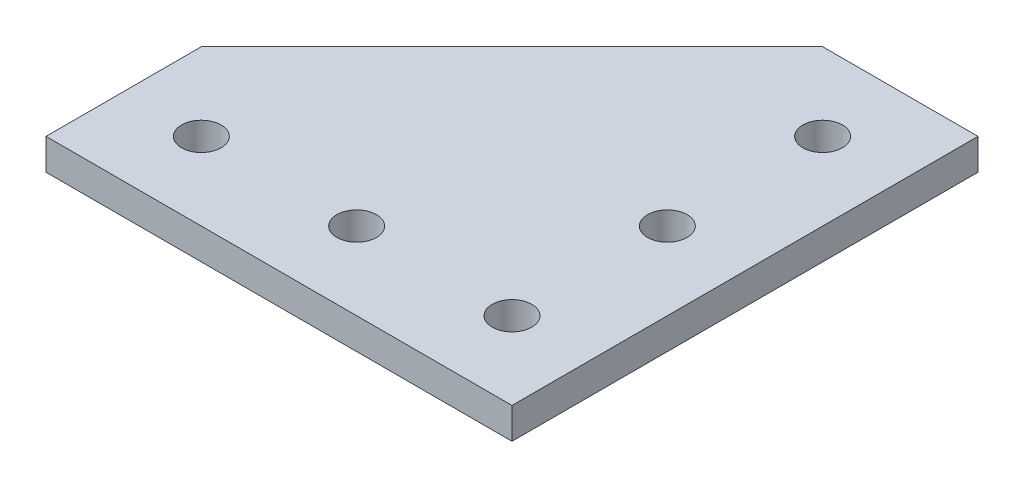
from build123d import *

# Parameters (mm, degrees)
SKETCH1_R           = 2.55
BOSS_EXTRUDE1_DEPTH = 4


with BuildPart() as part:
    # Sketch1 → Boss-Extrude1 (new body)
    with BuildSketch(Plane(origin=(0, 0, 0), x_dir=(1, 0, 0), z_dir=(0, 1, 0))):
        Polygon((10, -10), (-50, -10), (-50, 10), (-10, 50), (10, 50), align=None)
        with Locations(Location((-20, 0, 0), (0, 0, 270))):
            Circle(SKETCH1_R, mode=Mode.SUBTRACT)
        with Locations(Location((-40, 0, 0), (0, 0, 270))):
            Circle(SKETCH1_R, mode=Mode.SUBTRACT)
        with Locations(Location((0, 0, 0), (0, 0, 270))):
            Circle(SKETCH1_R, mode=Mode.SUBTRACT)
        with Locations(Location((0, 20, 0), (0, 0, 270))):
            Circle(SKETCH1_R, mode=Mode.SUBTRACT)
        with Locations(Location((0, 40, 0), (0, 0, 270))):
            Circle(SKETCH1_R, mode=Mode.SUBTRACT)
    extrude(amount=BOSS_EXTRUDE1_DEPTH)


solid = part.part
